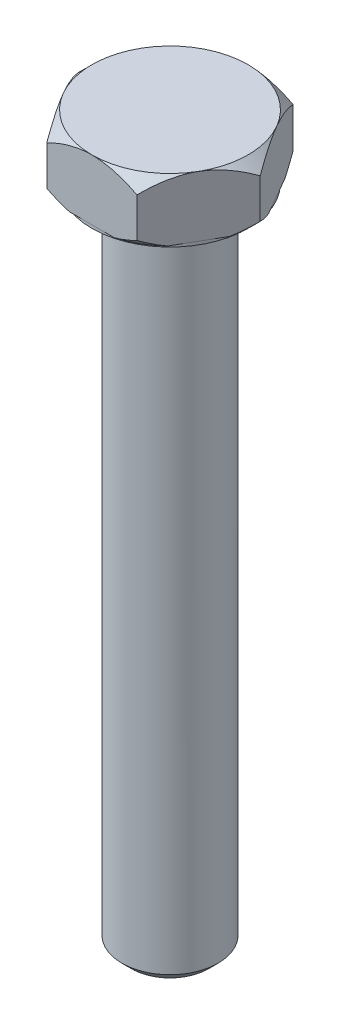
from build123d import *

# Parameters (mm, degrees)
BOSS_EXTRUDE1_DEPTH = 5.3
SKETCH2_OUTSIDE_W   = 21.122
SKETCH2_OUTSIDE_H   = 19.11
SKETCH2_OUTSIDE_R   = 6.5
CUT_EXTRUDE1_DEPTH  = 0.265
SKETCH3_R           = 4
BOSS_EXTRUDE2_DEPTH = 55
CHAMFER1_SIZE       = 0.8


with BuildPart() as part:
    # Sketch1 → Boss-Extrude1 (new body)
    with BuildSketch(Plane(origin=(0, 0, 0), x_dir=(1, 0, 0), z_dir=(0, 1, 0))):
        Polygon((7.505553499, 0), (3.75277675, 6.5), (-3.75277675, 6.5), (-7.505553499, 0), (-3.75277675, -6.5), (3.75277675, -6.5), align=None)
    extrude(amount=-BOSS_EXTRUDE1_DEPTH)

    # Sketch4 → Cut-Revolve1 (revolve, cut)
    with BuildSketch(Plane(origin=(0, 0, 0), x_dir=(0, 0, -1), z_dir=(1, 0, 0))):
        Polygon((-6.5, 0), (-8.15, 0), (-8.15, -1.65), align=None)
        Polygon((-8.15, -3.65), (-6.5, -5.3), (-8.15, -5.3), align=None)
    revolve(axis=Axis((0, 0, 0), (0, -1, 0)), mode=Mode.SUBTRACT)

    # Sketch2 outside → Cut-Extrude1 (cut)
    with BuildSketch(Plane.XZ.offset(5.3)):
        Rectangle(SKETCH2_OUTSIDE_W, SKETCH2_OUTSIDE_H)
        with Locations(Location((0, 0, 0), (0, 0, 90))):
            Circle(SKETCH2_OUTSIDE_R, mode=Mode.SUBTRACT)
    extrude(amount=-CUT_EXTRUDE1_DEPTH, mode=Mode.SUBTRACT)

    # Sketch3 → Boss-Extrude2 (add)
    with BuildSketch(Plane.XZ.offset(5.3)):
        with Locations(Location((0, 0, 0), (0, 0, 90))):
            Circle(SKETCH3_R)
    extrude(amount=BOSS_EXTRUDE2_DEPTH)

    # Chamfer1
    chamfer1_edges = [part.edges().sort_by_distance(p)[0] for p in [
        (0, -60.3, -4),
    ]]
    chamfer(chamfer1_edges, length=CHAMFER1_SIZE)


solid = part.part
